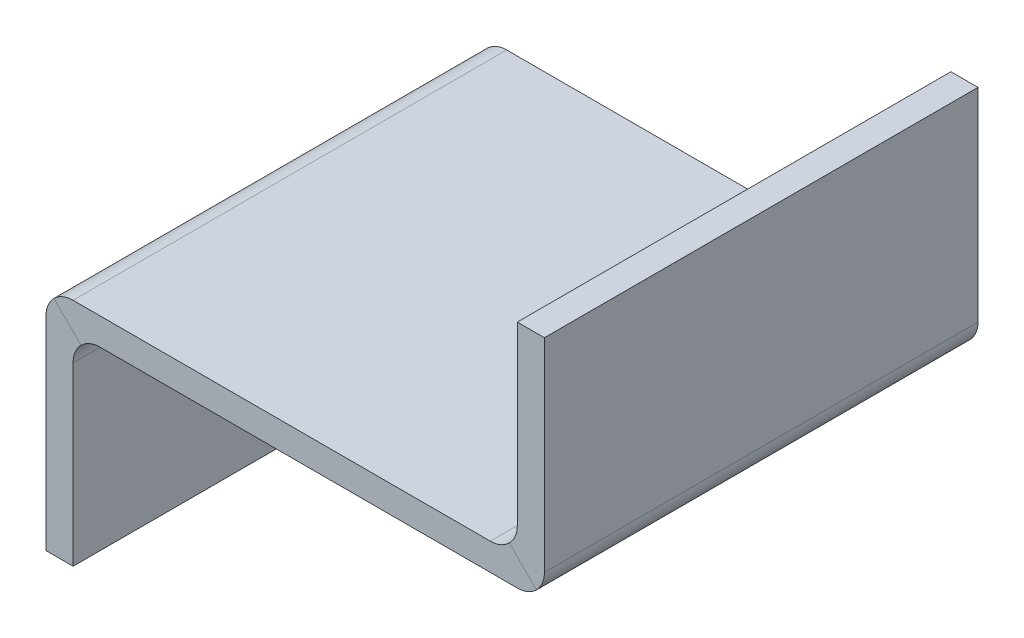
from build123d import *

# Parameters (mm, degrees)
SKETCH_2_W = 40
SKETCH_2_H = 2.5
FILLET_1_R = 2.5
FILLET_2_R = 2.5
FILLET_3_R = 2.5


with BuildPart() as part:
    # 扫描1: sweep along a path in 草图3
    with BuildLine(Plane.XY) as sweep_1_path:
        Line((21.74, 20), (21.74, 0))
        Line((21.74, 0), (0, 0))
        Line((0, 0), (-21.74, 0))
        Line((-21.74, 0), (-21.74, -20))
    # 草图2 → 扫描1 (sweep)
    with BuildSketch(Plane(origin=(0, 0, 0), x_dir=(0, 0, -1), z_dir=(1, 0, 0))):
        Rectangle(SKETCH_2_W, SKETCH_2_H)
    sweep(path=sweep_1_path.line, transition=Transition.RIGHT)

    # 圆角1
    fillet_1_edges = [part.edges().sort_by_distance(p)[0] for p in [
        (-22.99, 1.25, 0),
    ]]
    fillet(fillet_1_edges, radius=FILLET_1_R)

    # 圆角2
    fillet_2_edges = [part.edges().sort_by_distance(p)[0] for p in [
        (22.99, -1.25, 0),
    ]]
    fillet(fillet_2_edges, radius=FILLET_2_R)

    # 圆角3
    fillet_3_edges = [part.edges().sort_by_distance(p)[0] for p in [
        (-20.49, -1.25, 0),
        (20.49, 1.25, 0),
    ]]
    fillet(fillet_3_edges, radius=FILLET_3_R)


solid = part.part
